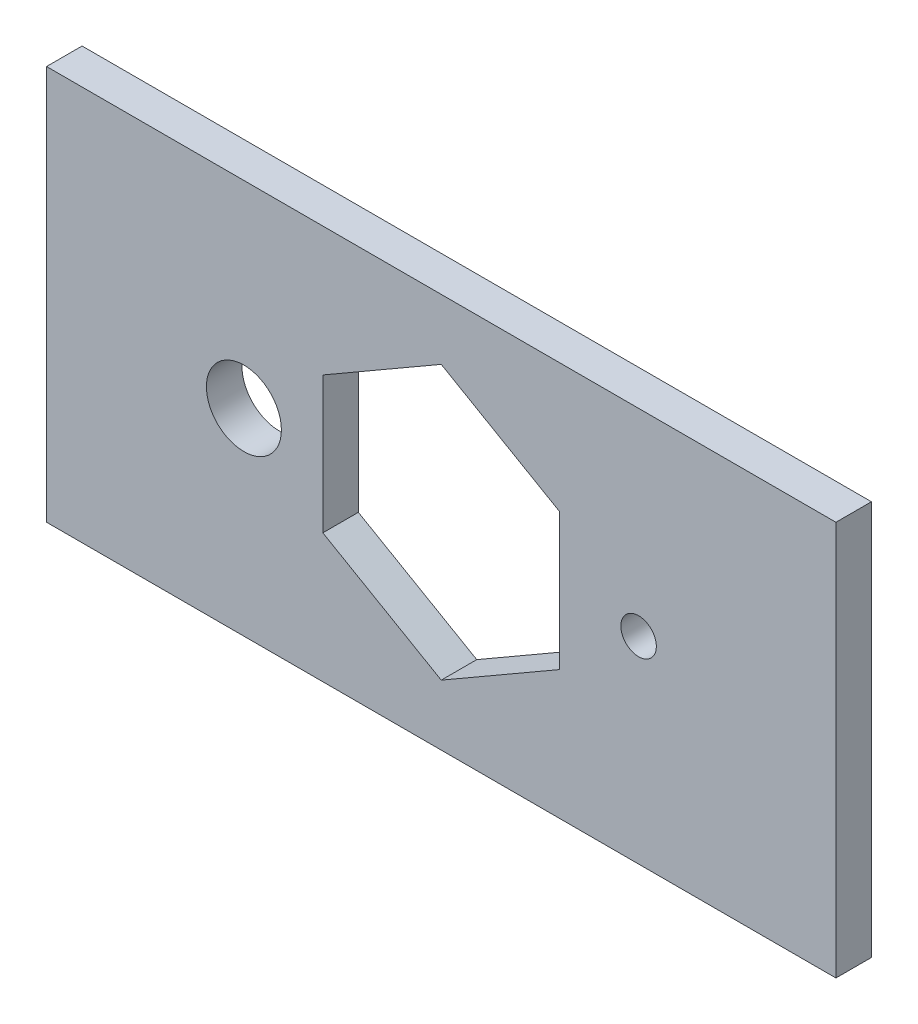
from build123d import *

# Parameters (mm, degrees)
SKETCH1_W           = 50.8
SKETCH1_H           = 25.4
SKETCH1_R           = 2.413
SKETCH1_R_2         = 1.143
BOSS_EXTRUDE1_DEPTH = 1.143


with BuildPart() as part:
    # Sketch1 → Boss-Extrude1 (new, symmetric)
    with BuildSketch(Plane.XY):
        Rectangle(SKETCH1_W, SKETCH1_H)
        with Locations((-12.7, 0)):
            Circle(SKETCH1_R, mode=Mode.SUBTRACT)
        with Locations((12.7, 0)):
            Circle(SKETCH1_R_2, mode=Mode.SUBTRACT)
        Polygon((7.62, 4.399409051), (0, 8.798818102), (-7.62, 4.399409051), (-7.62, -4.399409051), (0, -8.798818102), (7.62, -4.399409051), align=None, mode=Mode.SUBTRACT)
    extrude(amount=BOSS_EXTRUDE1_DEPTH, both=True)


solid = part.part
